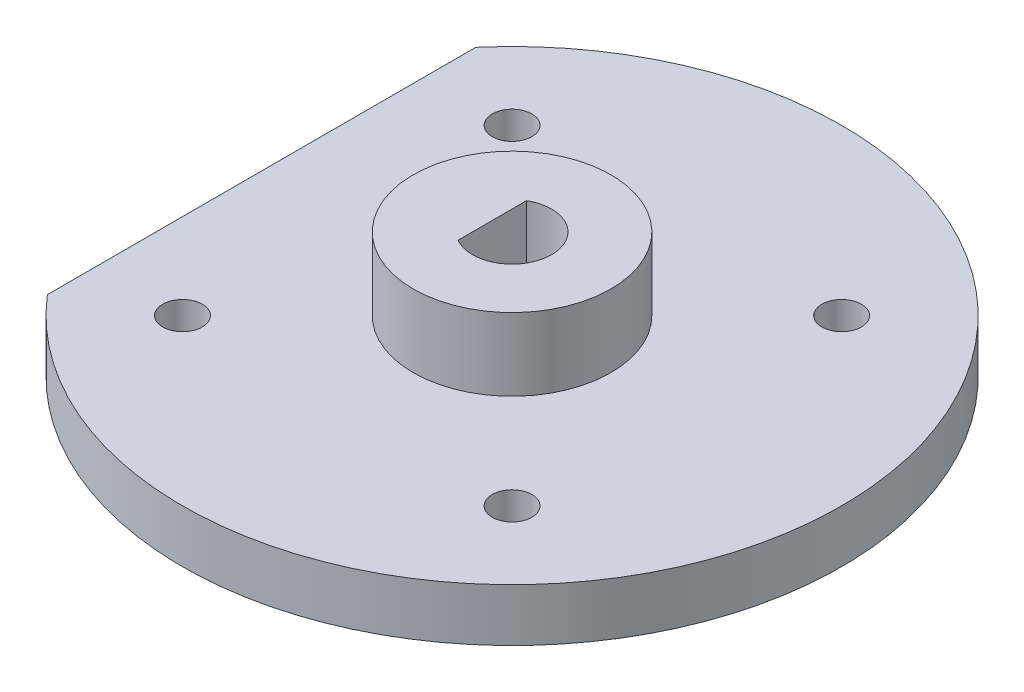
from build123d import *

# Parameters (mm, degrees)
SKETCH1_R           = 1.5
BOSS_EXTRUDE1_DEPTH = 4
SKETCH2_R           = 7.5
BOSS_EXTRUDE2_DEPTH = 5.5


with BuildPart() as part:
    # Sketch1 → Boss-Extrude1 (new body)
    with BuildSketch(Plane(origin=(0, 0, 0), x_dir=(1, 0, 0), z_dir=(0, 1, 0))):
        with BuildLine():
            Line((-19, 16.248076809), (-19, -16.248076809))
            ThreePointArc((-19, -16.248076809), (25, 0), (-19, 16.248076809))
        make_face()
        with Locations(Location((12.5, 12.5, 0), (0, 0, 270))):
            Circle(SKETCH1_R, mode=Mode.SUBTRACT)
        with Locations(Location((12.5, -12.5, 0), (0, 0, 270))):
            Circle(SKETCH1_R, mode=Mode.SUBTRACT)
        with Locations(Location((-12.5, -12.5, 0), (0, 0, 270))):
            Circle(SKETCH1_R, mode=Mode.SUBTRACT)
        with Locations(Location((-12.5, 12.5, 0), (0, 0, 270))):
            Circle(SKETCH1_R, mode=Mode.SUBTRACT)
        with BuildLine():
            Line((-1.5, 2.598076211), (-1.5, -2.598076211))
            ThreePointArc((-1.5, -2.598076211), (3, 0), (-1.5, 2.598076211))
        make_face(mode=Mode.SUBTRACT)
    extrude(amount=BOSS_EXTRUDE1_DEPTH)

    # Sketch2 → Boss-Extrude2 (add)
    with BuildSketch(Plane(origin=(0, 4, 0), x_dir=(1, 0, 0), z_dir=(0, 1, 0))):
        with Locations(Location((0, 0, 0), (0, 0, 270))):
            Circle(SKETCH2_R)
        with BuildLine():
            Line((-1.5, 2.598076211), (-1.5, -2.598076211))
            ThreePointArc((-1.5, -2.598076211), (3, 0), (-1.5, 2.598076211))
        make_face(mode=Mode.SUBTRACT)
    extrude(amount=BOSS_EXTRUDE2_DEPTH)


solid = part.part
